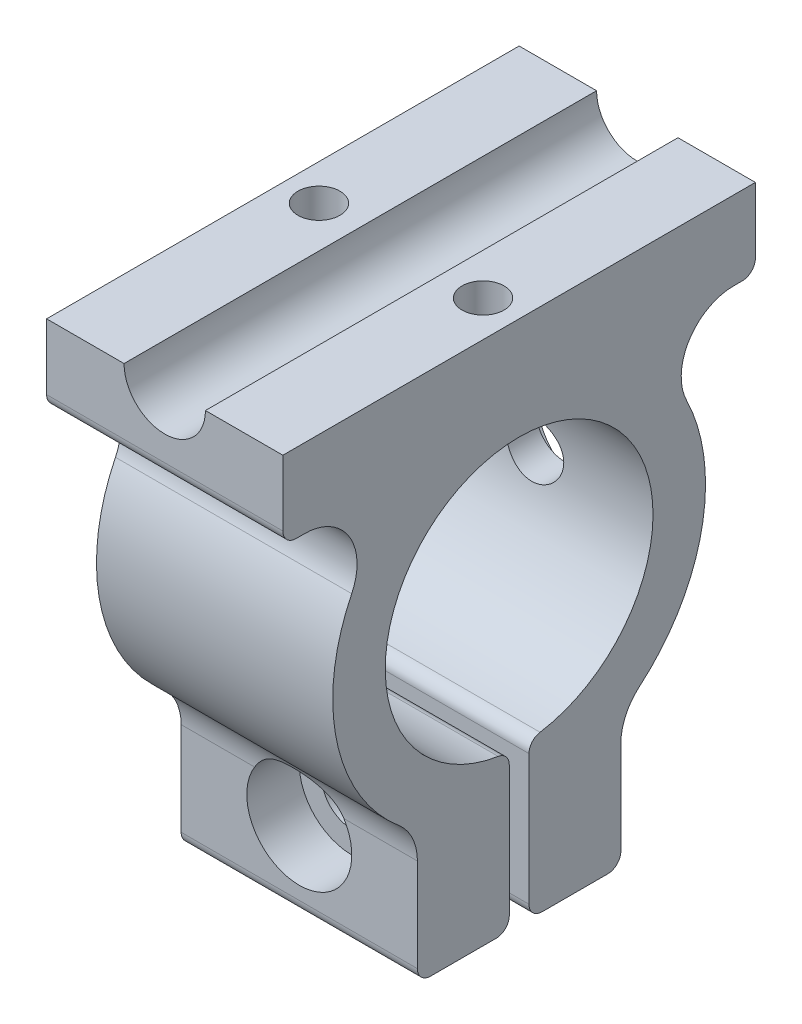
from build123d import *

# Parameters (mm, degrees)
EXTRUDE_1_DEPTH               = 9
CUT_EXTRUDE_1_DEPTH           = 30.816103032
CUT_EXTRUDE_1_DEPTH_BACK      = 30.816103032
SKETCH_2_R                    = 2.3
CUT_EXTRUDE_2_DEPTH           = 3.3
CUT_EXTRUDE_2_OTHER_WAY_DEPTH = 36.043722716
CUT_EXTRUDE_2_OTHER_WAY_TAPER = 1
CUT_EXTRUDE_3_DEPTH           = 36.043722716
CUT_EXTRUDE_3_DEPTH_BACK      = 4
CUT_EXTRUDE_4_REACH           = 46.777
CUT_EXTRUDE_4_END_RADIUS      = 10.2
SKETCH_5_R                    = 1.6
SKETCH_6_R                    = 2.2
CUT_EXTRUDE_5_DEPTH           = 30.816103062
CUT_EXTRUDE_START             = -5.5
SKETCH_7_R                    = 4
SKETCH_7_R_2                  = 2.2
CUT_EXTRUDE_6_DEPTH           = 5.5


with BuildPart() as part:
    # Эскиз1 → Бобышка-Вытянуть1 (new, symmetric)
    with BuildSketch(Plane(origin=(0, 0, 0), x_dir=(0, 0, -1), z_dir=(1, 0, 0))):
        with BuildLine():
            Line((-0.75, -21), (-0.75, -11.06243644))
            ThreePointArc((-0.75, -11.06243644), (-0.989654684, -10.412917388), (-1.59375, -10.074718901))
            ThreePointArc((-1.59375, -10.074718901), (0, 10.2), (1.59375, -10.074718901))
            ThreePointArc((1.59375, -10.074718901), (0.989654684, -10.412917388), (0.75, -11.06243644))
            Line((0.75, -11.06243644), (0.75, -21))
            ThreePointArc((0.75, -21), (1.042893219, -21.707106781), (1.75, -22))
            Line((1.75, -22), (6.75, -22))
            ThreePointArc((6.75, -22), (7.457106781, -21.707106781), (7.75, -21))
            Line((7.75, -21), (7.75, -13.898830886))
            ThreePointArc((7.75, -13.898830886), (8.121662204, -12.215036114), (9.167582418, -10.844142779))
            ThreePointArc((9.167582418, -10.844142779), (13.897042702, -2.917568189), (12.75462481, 6.241758242))
            ThreePointArc((12.75462481, 6.241758242), (12.953882386, 10.117431577), (16.34747687, 12))
            Line((16.34747687, 12), (17, 12))
            ThreePointArc((17, 12), (17.707106781, 12.292893219), (18, 13))
            Line((18, 13), (18, 18))
            Line((18, 18), (-18, 18))
            Line((-18, 18), (-18, 13))
            ThreePointArc((-18, 13), (-17.707106781, 12.292893219), (-17, 12))
            Line((-17, 12), (-16.34747687, 12))
            ThreePointArc((-16.34747687, 12), (-12.953882386, 10.117431577), (-12.75462481, 6.241758242))
            ThreePointArc((-12.75462481, 6.241758242), (-13.897042702, -2.917568189), (-9.167582418, -10.844142779))
            ThreePointArc((-9.167582418, -10.844142779), (-8.121662204, -12.215036114), (-7.75, -13.898830886))
            Line((-7.75, -13.898830886), (-7.75, -21))
            ThreePointArc((-7.75, -21), (-7.457106781, -21.707106781), (-6.75, -22))
            Line((-6.75, -22), (-1.75, -22))
            ThreePointArc((-1.75, -22), (-1.042893219, -21.707106781), (-0.75, -21))
        make_face()
    extrude(amount=EXTRUDE_1_DEPTH, both=True)

    # Эскиз2 → Вырез-Вытянуть1 (cut, two sides: drawn at the far end of the back side and taken through both)
    with BuildSketch(Plane.XY.offset(-CUT_EXTRUDE_1_DEPTH_BACK)):
        with BuildLine():
            ThreePointArc((-3.1, 18), (0, 14.9), (3.1, 18))
            Line((3.1, 18), (-3.1, 18))
        make_face()
        with Locations(Location((0, -16, 0), (0, 0, 66.000891847))):
            Circle(SKETCH_2_R)
    extrude(amount=CUT_EXTRUDE_1_DEPTH + CUT_EXTRUDE_1_DEPTH_BACK, mode=Mode.SUBTRACT)

    # Эскиз3 → Вырез-Вытянуть2 (cut)
    with BuildSketch(Plane(origin=(0, 0, -7.75), x_dir=(-1, 0, 0), z_dir=(0, 0, -1))):
        Polygon((-4.618802154, -16), (-2.309401077, -20), (2.309401077, -20), (4.618802154, -16), (2.309401077, -12), (-2.309401077, -12), align=None)
    extrude(amount=-CUT_EXTRUDE_2_DEPTH, mode=Mode.SUBTRACT)

    # Эскиз3 → Вырез-Вытянуть2 other way (cut)
    with BuildSketch(Plane(origin=(0, 0, -7.75), x_dir=(-1, 0, 0), z_dir=(0, 0, -1))):
        Polygon((-4.618802154, -16), (-2.309401077, -20), (2.309401077, -20), (4.618802154, -16), (2.309401077, -12), (-2.309401077, -12), align=None)
    extrude(amount=CUT_EXTRUDE_2_OTHER_WAY_DEPTH, taper=CUT_EXTRUDE_2_OTHER_WAY_TAPER, mode=Mode.SUBTRACT)

    # Эскиз4 → Вырез-Вытянуть3 (cut, two sides: drawn at the far end of the back side and taken through both)
    with BuildSketch(Plane.XY.offset(7.75).offset(-CUT_EXTRUDE_3_DEPTH_BACK)):
        with BuildLine():
            Line((-3.403687464, -13.898830886), (-0.935461573, -13.898830886))
            ThreePointArc((-0.935461573, -13.898830886), (0, -18.3), (0.935461573, -13.898830886))
            Line((0.935461573, -13.898830886), (3.403687464, -13.898830886))
            ThreePointArc((3.403687464, -13.898830886), (0, -12), (-3.403687464, -13.898830886))
        make_face()
        with BuildLine():
            ThreePointArc((0.935461573, -13.898830886), (0, -18.3), (-0.935461573, -13.898830886))
            Line((-0.935461573, -13.898830886), (-3.403687464, -13.898830886))
            ThreePointArc((-3.403687464, -13.898830886), (-1.092073748, -19.848035204), (4, -16))
            ThreePointArc((4, -16), (3.848035204, -14.907926252), (3.403687464, -13.898830886))
            Line((3.403687464, -13.898830886), (0.935461573, -13.898830886))
        make_face()
        with BuildLine():
            Line((-3.403687464, -13.898830886), (-0.935461573, -13.898830886))
            ThreePointArc((-0.935461573, -13.898830886), (0, -18.3), (0.935461573, -13.898830886))
            Line((0.935461573, -13.898830886), (3.403687464, -13.898830886))
            ThreePointArc((3.403687464, -13.898830886), (0, -12), (-3.403687464, -13.898830886))
        make_face()
        with BuildLine():
            ThreePointArc((0.935461573, -13.898830886), (0, -18.3), (-0.935461573, -13.898830886))
            Line((-0.935461573, -13.898830886), (-3.403687464, -13.898830886))
            ThreePointArc((-3.403687464, -13.898830886), (-1.092073748, -19.848035204), (4, -16))
            ThreePointArc((4, -16), (3.848035204, -14.907926252), (3.403687464, -13.898830886))
            Line((3.403687464, -13.898830886), (0.935461573, -13.898830886))
        make_face()
    extrude(amount=CUT_EXTRUDE_3_DEPTH + CUT_EXTRUDE_3_DEPTH_BACK, mode=Mode.SUBTRACT)

    # Вырез-Вытянуть4: up to this cylinder (the profile starts outside it)
    cut_extrude_4_end = Plane(origin=(0, 0, 0), z_dir=(-1, 0, 0)) * Cylinder(CUT_EXTRUDE_4_END_RADIUS, 127.454, mode=Mode.PRIVATE)
    # Эскиз5 → Вырез-Вытянуть4 (cut, up to the surface)
    with BuildSketch(Plane(origin=(0, 18, 0), x_dir=(1, 0, 0), z_dir=(0, 1, 0)), mode=Mode.PRIVATE) as cut_extrude_4_sk1:
        with Locations(Location((6.25, 0, 0), (0, 0, 270))):
            Circle(SKETCH_5_R)
    cut_extrude_4_tool1 = extrude(cut_extrude_4_sk1.sketch, amount=-CUT_EXTRUDE_4_REACH, mode=Mode.PRIVATE) - cut_extrude_4_end
    add(cut_extrude_4_tool1.solids().sort_by_distance((6.25, 18, 0))[0], mode=Mode.SUBTRACT)
    # Эскиз5 → Вырез-Вытянуть4 (cut, up to the surface)
    with BuildSketch(Plane(origin=(0, 18, 0), x_dir=(1, 0, 0), z_dir=(0, 1, 0)), mode=Mode.PRIVATE) as cut_extrude_4_sk2:
        with Locations(Location((-6.25, 0, 0), (0, 0, 270))):
            Circle(SKETCH_5_R)
    cut_extrude_4_tool2 = extrude(cut_extrude_4_sk2.sketch, amount=-CUT_EXTRUDE_4_REACH, mode=Mode.PRIVATE) - cut_extrude_4_end
    add(cut_extrude_4_tool2.solids().sort_by_distance((-6.25, 18, 0))[0], mode=Mode.SUBTRACT)

    # Эскиз6 → Вырез-Вытянуть5 (cut, through all)
    with BuildSketch(Plane.XY):
        Circle(SKETCH_6_R)
    extrude(amount=-CUT_EXTRUDE_5_DEPTH, mode=Mode.SUBTRACT)

    # Эскиз7 → Вырез-Вытянуть6 (cut)
    with BuildSketch(Plane(origin=(0, 0, -18), x_dir=(-1, 0, 0), z_dir=(0, 0, -1)).offset(CUT_EXTRUDE_START)):
        Circle(SKETCH_7_R)
        with Locations(Location((0, 0, 0), (0, 0, 180))):
            Circle(SKETCH_7_R_2, mode=Mode.SUBTRACT)
    extrude(amount=CUT_EXTRUDE_6_DEPTH, mode=Mode.SUBTRACT)


solid = part.part
